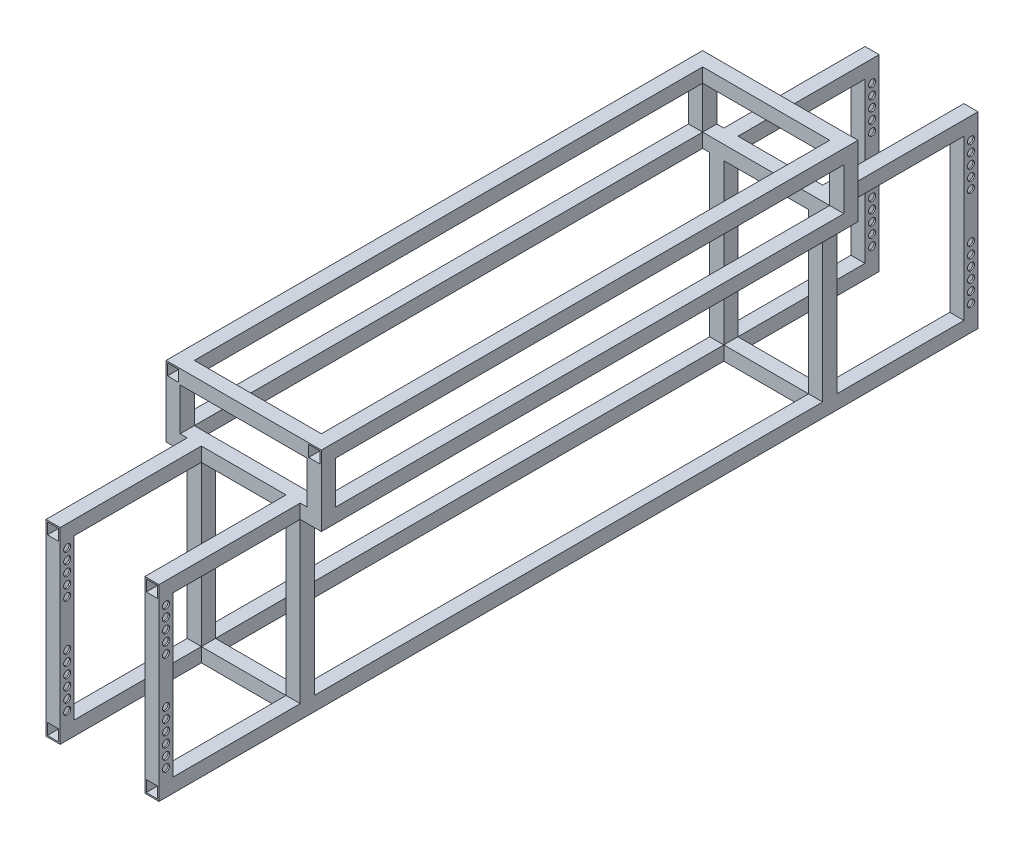
from build123d import *

# Parameters (mm, degrees)
SZKIC1_W                     = 20
SZKIC1_H                     = 20
SZKIC1_W_2                   = 16
SZKIC1_H_2                   = 16
DODANIE_WYCI_GNI_CIE1_DEPTH  = 760
SZKIC2_W                     = 20
SZKIC2_H                     = 20
SZKIC2_W_2                   = 16
SZKIC2_H_2                   = 16
DODANIE_WYCI_GNI_CIE2_DEPTH  = 180
SZKIC3_W                     = 20
SZKIC3_H                     = 20
SZKIC3_W_2                   = 16
SZKIC3_H_2                   = 16
DODANIE_WYCI_GNI_CIE3_DEPTH  = 180
SZKIC4_W                     = 20
SZKIC4_H                     = 20
SZKIC4_W_2                   = 16
SZKIC4_H_2                   = 16
DODANIE_WYCI_GNI_CIE4_DEPTH  = 760
SZKIC5_W                     = 20
SZKIC5_H                     = 20
SZKIC5_W_2                   = 16
SZKIC5_H_2                   = 16
DODANIE_WYCI_GNI_CIE5_DEPTH  = 80
DODANIE_WYCI_GNI_CIE6_REACH  = 776.468
SZKIC6_W                     = 20
SZKIC6_H                     = 20
SZKIC6_W_2                   = 16
SZKIC6_H_2                   = 16
DODANIE_WYCI_GNI_CIE7_REACH  = 793.012
SZKIC7_W                     = 20
SZKIC7_H                     = 20
SZKIC7_W_2                   = 16
SZKIC7_H_2                   = 16
SZKIC8_W                     = 20
SZKIC8_H                     = 20
SZKIC8_W_2                   = 16
SZKIC8_H_2                   = 16
DODANIE_WYCI_GNI_CIE8_DEPTH  = 200
SZKIC9_W                     = 20
SZKIC9_H                     = 20
SZKIC9_W_2                   = 16
SZKIC9_H_2                   = 16
DODANIE_WYCI_GNI_CIE9_DEPTH  = 200
SZKIC10_W                    = 20
SZKIC10_H                    = 20
SZKIC10_W_2                  = 16
SZKIC10_H_2                  = 16
DODANIE_WYCI_GNI_CIE10_DEPTH = 226
SZKIC11_W                    = 20
SZKIC11_H                    = 20
SZKIC11_W_2                  = 16
SZKIC11_H_2                  = 16
DODANIE_WYCI_GNI_CIE11_DEPTH = 246
DODANIE_WYCI_GNI_CIE12_REACH = 1022.096
SZKIC12_W                    = 20
SZKIC12_H                    = 20
SZKIC12_W_2                  = 16
SZKIC12_H_2                  = 16
DODANIE_WYCI_GNI_CIE13_REACH = 1033.211
SZKIC13_W                    = 20
SZKIC13_H                    = 20
SZKIC13_W_2                  = 16
SZKIC13_H_2                  = 16
SZKIC14_R                    = 5
WYTNIJ_WYCI_GNI_CIE1_DEPTH   = 180
SZKIC15_R                    = 5
WYTNIJ_WYCI_GNI_CIE2_DEPTH   = 180


with BuildPart() as part:
    # Szkic1 → Dodanie-wyciągnięcie1 (new body)
    with BuildSketch(Plane.XY):
        Rectangle(SZKIC1_W, SZKIC1_H)
        Rectangle(SZKIC1_W_2, SZKIC1_H_2, mode=Mode.SUBTRACT)
    extrude(amount=DODANIE_WYCI_GNI_CIE1_DEPTH)

    # Szkic2 → Dodanie-wyciągnięcie2 (add)
    with BuildSketch(Plane(origin=(10, 0, 0), x_dir=(0, 0, -1), z_dir=(1, 0, 0))):
        with Locations((-750, 0)):
            Rectangle(SZKIC2_W, SZKIC2_H)
        with Locations((-750, 0)):
            Rectangle(SZKIC2_W_2, SZKIC2_H_2, mode=Mode.SUBTRACT)
    extrude(amount=DODANIE_WYCI_GNI_CIE2_DEPTH)

    # Szkic3 → Dodanie-wyciągnięcie3 (add)
    with BuildSketch(Plane(origin=(10, 0, 0), x_dir=(0, 0, -1), z_dir=(1, 0, 0))):
        with Locations((-10, 0)):
            Rectangle(SZKIC3_W, SZKIC3_H)
        with Locations((-10, 0)):
            Rectangle(SZKIC3_W_2, SZKIC3_H_2, mode=Mode.SUBTRACT)
    extrude(amount=DODANIE_WYCI_GNI_CIE3_DEPTH)

    # Szkic4 → Dodanie-wyciągnięcie4 (add)
    with BuildSketch(Plane.XY.offset(760)):
        with Locations((200, 0)):
            Rectangle(SZKIC4_W, SZKIC4_H)
        with Locations((200, 0)):
            Rectangle(SZKIC4_W_2, SZKIC4_H_2, mode=Mode.SUBTRACT)
    extrude(amount=-DODANIE_WYCI_GNI_CIE4_DEPTH)

    # Szkic5 → Dodanie-wyciągnięcie5 (add)
    # profile 1 of 4: a face of its own
    with BuildSketch(Plane.XZ.offset(10)):
        with Locations((0, 750)):
            Rectangle(SZKIC5_W, SZKIC5_H)
        with Locations((0, 750)):
            Rectangle(SZKIC5_W_2, SZKIC5_H_2, mode=Mode.SUBTRACT)
    # profile 2 of 4: a face of its own
    with BuildSketch(Plane.XZ.offset(10)):
        with Locations((200, 750)):
            Rectangle(SZKIC5_W, SZKIC5_H)
        with Locations((200, 750)):
            Rectangle(SZKIC5_W_2, SZKIC5_H_2, mode=Mode.SUBTRACT)
    # profile 3 of 4: a face of its own
    with BuildSketch(Plane.XZ.offset(10)):
        with Locations((0, 10)):
            Rectangle(SZKIC5_W, SZKIC5_H)
        with Locations((0, 10)):
            Rectangle(SZKIC5_W_2, SZKIC5_H_2, mode=Mode.SUBTRACT)
    # profile 4 of 4: a face of its own
    with BuildSketch(Plane.XZ.offset(10)):
        with Locations((200, 10)):
            Rectangle(SZKIC5_W, SZKIC5_H)
        with Locations((200, 10)):
            Rectangle(SZKIC5_W_2, SZKIC5_H_2, mode=Mode.SUBTRACT)
    extrude(amount=DODANIE_WYCI_GNI_CIE5_DEPTH)

    # Szkic6 → Dodanie-wyciągnięcie6 (add, up to next)
    with BuildSketch(Plane.XY.offset(20), mode=Mode.PRIVATE) as dodanie_wyci_gni_cie6_sk1:
        with Locations((200, -80)):
            Rectangle(SZKIC6_W, SZKIC6_H)
        with Locations((200, -80)):
            Rectangle(SZKIC6_W_2, SZKIC6_H_2, mode=Mode.SUBTRACT)
    dodanie_wyci_gni_cie6_tool1 = extrude(dodanie_wyci_gni_cie6_sk1.sketch, amount=DODANIE_WYCI_GNI_CIE6_REACH, mode=Mode.PRIVATE) - part.part
    # Szkic6 → Dodanie-wyciągnięcie6 (add, up to next)
    with BuildSketch(Plane.XY.offset(20), mode=Mode.PRIVATE) as dodanie_wyci_gni_cie6_sk2:
        with Locations((0, -80)):
            Rectangle(SZKIC6_W, SZKIC6_H)
        with Locations((0, -80)):
            Rectangle(SZKIC6_W_2, SZKIC6_H_2, mode=Mode.SUBTRACT)
    dodanie_wyci_gni_cie6_tool2 = extrude(dodanie_wyci_gni_cie6_sk2.sketch, amount=DODANIE_WYCI_GNI_CIE6_REACH, mode=Mode.PRIVATE) - part.part
    add(dodanie_wyci_gni_cie6_tool1.solids().sort_by_distance((200, -89.717157, 20))[0])
    add(dodanie_wyci_gni_cie6_tool2.solids().sort_by_distance((0, -89.717157, 20))[0])

    # Szkic7 → Dodanie-wyciągnięcie7 (add, up to next)
    with BuildSketch(Plane(origin=(10, 0, 0), x_dir=(0, 0, -1), z_dir=(1, 0, 0)), mode=Mode.PRIVATE) as dodanie_wyci_gni_cie7_sk1:
        with Locations((-750, -80)):
            Rectangle(SZKIC7_W, SZKIC7_H)
        with Locations((-750, -80)):
            Rectangle(SZKIC7_W_2, SZKIC7_H_2, mode=Mode.SUBTRACT)
    dodanie_wyci_gni_cie7_tool1 = extrude(dodanie_wyci_gni_cie7_sk1.sketch, amount=DODANIE_WYCI_GNI_CIE7_REACH, mode=Mode.PRIVATE) - part.part
    # Szkic7 → Dodanie-wyciągnięcie7 (add, up to next)
    with BuildSketch(Plane(origin=(10, 0, 0), x_dir=(0, 0, -1), z_dir=(1, 0, 0)), mode=Mode.PRIVATE) as dodanie_wyci_gni_cie7_sk2:
        with Locations((-10, -80)):
            Rectangle(SZKIC7_W, SZKIC7_H)
        with Locations((-10, -80)):
            Rectangle(SZKIC7_W_2, SZKIC7_H_2, mode=Mode.SUBTRACT)
    dodanie_wyci_gni_cie7_tool2 = extrude(dodanie_wyci_gni_cie7_sk2.sketch, amount=DODANIE_WYCI_GNI_CIE7_REACH, mode=Mode.PRIVATE) - part.part
    add(dodanie_wyci_gni_cie7_tool1.solids().sort_by_distance((10, -89.717157, 750))[0])
    add(dodanie_wyci_gni_cie7_tool2.solids().sort_by_distance((10, -89.717157, 10))[0])

    # Szkic8 → Dodanie-wyciągnięcie8 (add)
    # profile 1 of 2: a face of its own
    with BuildSketch(Plane(origin=(0, 0, 0), x_dir=(-1, 0, 0), z_dir=(0, 0, -1))):
        with Locations((-30, -80)):
            Rectangle(SZKIC8_W, SZKIC8_H)
        with Locations((-30, -80)):
            Rectangle(SZKIC8_W_2, SZKIC8_H_2, mode=Mode.SUBTRACT)
    # profile 2 of 2: a face of its own
    with BuildSketch(Plane(origin=(0, 0, 0), x_dir=(-1, 0, 0), z_dir=(0, 0, -1))):
        with Locations((-170, -80)):
            Rectangle(SZKIC8_W, SZKIC8_H)
        with Locations((-170, -80)):
            Rectangle(SZKIC8_W_2, SZKIC8_H_2, mode=Mode.SUBTRACT)
    dodanie_wyci_gni_cie8 = extrude(amount=DODANIE_WYCI_GNI_CIE8_DEPTH)

    # Szkic9 → Dodanie-wyciągnięcie9 (add)
    # profile 1 of 2: a face of its own
    with BuildSketch(Plane.XY.offset(760)):
        with Locations((170, -80)):
            Rectangle(SZKIC9_W, SZKIC9_H)
        with Locations((170, -80)):
            Rectangle(SZKIC9_W_2, SZKIC9_H_2, mode=Mode.SUBTRACT)
    # profile 2 of 2: a face of its own
    with BuildSketch(Plane.XY.offset(760)):
        with Locations((30, -80)):
            Rectangle(SZKIC9_W, SZKIC9_H)
        with Locations((30, -80)):
            Rectangle(SZKIC9_W_2, SZKIC9_H_2, mode=Mode.SUBTRACT)
    dodanie_wyci_gni_cie9 = extrude(amount=DODANIE_WYCI_GNI_CIE9_DEPTH)

    # Szkic10 → Dodanie-wyciągnięcie10 (add)
    # profile 1 of 2: a face of its own
    with BuildSketch(Plane.XZ.offset(90)):
        with Locations((170, 950)):
            Rectangle(SZKIC10_W, SZKIC10_H)
        with Locations((170, 950)):
            Rectangle(SZKIC10_W_2, SZKIC10_H_2, mode=Mode.SUBTRACT)
    # profile 2 of 2: a face of its own
    with BuildSketch(Plane.XZ.offset(90)):
        with Locations((30, 950)):
            Rectangle(SZKIC10_W, SZKIC10_H)
        with Locations((30, 950)):
            Rectangle(SZKIC10_W_2, SZKIC10_H_2, mode=Mode.SUBTRACT)
    dodanie_wyci_gni_cie10 = extrude(amount=DODANIE_WYCI_GNI_CIE10_DEPTH)

    # Lustro1: Dodanie-wyciągnięcie10 across plane
    add(dodanie_wyci_gni_cie10.mirror(Plane(origin=(0, 0, 380), x_dir=(1, 0, 0), z_dir=(0, 0, -1))))

    # Lustro2: Dodanie-wyciągnięcie8, Dodanie-wyciągnięcie9 across plane
    add(dodanie_wyci_gni_cie8.mirror(Plane(origin=(0, -203, 0), x_dir=(0, 0, 1), z_dir=(0, -1, 0))))
    add(dodanie_wyci_gni_cie9.mirror(Plane(origin=(0, -203, 0), x_dir=(0, 0, 1), z_dir=(0, -1, 0))))

    # Szkic11 → Dodanie-wyciągnięcie11 (add)
    # profile 1 of 4: a face of its own
    with BuildSketch(Plane.XZ.offset(90)):
        with Locations((30, 10)):
            Rectangle(SZKIC11_W, SZKIC11_H)
        with Locations((30, 10)):
            Rectangle(SZKIC11_W_2, SZKIC11_H_2, mode=Mode.SUBTRACT)
    # profile 2 of 4: a face of its own
    with BuildSketch(Plane.XZ.offset(90)):
        with Locations((170, 10)):
            Rectangle(SZKIC11_W, SZKIC11_H)
        with Locations((170, 10)):
            Rectangle(SZKIC11_W_2, SZKIC11_H_2, mode=Mode.SUBTRACT)
    # profile 3 of 4: a face of its own
    with BuildSketch(Plane.XZ.offset(90)):
        with Locations((30, 750)):
            Rectangle(SZKIC11_W, SZKIC11_H)
        with Locations((30, 750)):
            Rectangle(SZKIC11_W_2, SZKIC11_H_2, mode=Mode.SUBTRACT)
    # profile 4 of 4: a face of its own
    with BuildSketch(Plane.XZ.offset(90)):
        with Locations((170, 750)):
            Rectangle(SZKIC11_W, SZKIC11_H)
        with Locations((170, 750)):
            Rectangle(SZKIC11_W_2, SZKIC11_H_2, mode=Mode.SUBTRACT)
    extrude(amount=DODANIE_WYCI_GNI_CIE11_DEPTH)

    # Szkic12 → Dodanie-wyciągnięcie12 (add, up to next)
    with BuildSketch(Plane(origin=(0, 0, 740), x_dir=(-1, 0, 0), z_dir=(0, 0, -1)), mode=Mode.PRIVATE) as dodanie_wyci_gni_cie12_sk1:
        with Locations((-170, -326)):
            Rectangle(SZKIC12_W, SZKIC12_H)
        with Locations((-170, -326)):
            Rectangle(SZKIC12_W_2, SZKIC12_H_2, mode=Mode.SUBTRACT)
    dodanie_wyci_gni_cie12_tool1 = extrude(dodanie_wyci_gni_cie12_sk1.sketch, amount=DODANIE_WYCI_GNI_CIE12_REACH, mode=Mode.PRIVATE) - part.part
    # Szkic12 → Dodanie-wyciągnięcie12 (add, up to next)
    with BuildSketch(Plane(origin=(0, 0, 740), x_dir=(-1, 0, 0), z_dir=(0, 0, -1)), mode=Mode.PRIVATE) as dodanie_wyci_gni_cie12_sk2:
        with Locations((-30, -326)):
            Rectangle(SZKIC12_W, SZKIC12_H)
        with Locations((-30, -326)):
            Rectangle(SZKIC12_W_2, SZKIC12_H_2, mode=Mode.SUBTRACT)
    dodanie_wyci_gni_cie12_tool2 = extrude(dodanie_wyci_gni_cie12_sk2.sketch, amount=DODANIE_WYCI_GNI_CIE12_REACH, mode=Mode.PRIVATE) - part.part
    add(dodanie_wyci_gni_cie12_tool1.solids().sort_by_distance((170, -335.717157, 740))[0])
    add(dodanie_wyci_gni_cie12_tool2.solids().sort_by_distance((30, -335.717157, 740))[0])

    # Szkic13 → Dodanie-wyciągnięcie13 (add, up to next)
    with BuildSketch(Plane(origin=(40, 0, 0), x_dir=(0, 0, -1), z_dir=(1, 0, 0)), mode=Mode.PRIVATE) as dodanie_wyci_gni_cie13_sk1:
        with Locations((-750, -326)):
            Rectangle(SZKIC13_W, SZKIC13_H)
        with Locations((-750, -326)):
            Rectangle(SZKIC13_W_2, SZKIC13_H_2, mode=Mode.SUBTRACT)
    dodanie_wyci_gni_cie13_tool1 = extrude(dodanie_wyci_gni_cie13_sk1.sketch, amount=DODANIE_WYCI_GNI_CIE13_REACH, mode=Mode.PRIVATE) - part.part
    dodanie_wyci_gni_cie13 = dodanie_wyci_gni_cie13_tool1.solids().sort_by_distance((40, -316.282843, 750))[0]
    add(dodanie_wyci_gni_cie13)

    # Lustro3: Dodanie-wyciągnięcie13 across plane
    add(dodanie_wyci_gni_cie13.mirror(Plane(origin=(0, 0, 380), x_dir=(1, 0, 0), z_dir=(0, 0, -1))))

    # Szkic14 → Wytnij-wyciągnięcie1 (cut)
    with BuildSketch(Plane(origin=(180, 0, 0), x_dir=(0, 0, -1), z_dir=(1, 0, 0))):
        with Locations((-950, -100)):
            Circle(SZKIC14_R)
        with Locations((-950, -115)):
            Circle(SZKIC14_R)
        with Locations((-950, -130)):
            Circle(SZKIC14_R)
        with Locations((-950, -145)):
            Circle(SZKIC14_R)
        with Locations((-950, -160)):
            Circle(SZKIC14_R)
    wytnij_wyci_gni_cie1 = extrude(amount=-WYTNIJ_WYCI_GNI_CIE1_DEPTH, mode=Mode.SUBTRACT)

    # Lustro4: Wytnij-wyciągnięcie1 across plane
    add(wytnij_wyci_gni_cie1.mirror(Plane(origin=(0, 0, 380), x_dir=(1, 0, 0), z_dir=(0, 0, -1))), mode=Mode.SUBTRACT)

    # Szkic15 → Wytnij-wyciągnięcie2 (cut)
    with BuildSketch(Plane(origin=(180, 0, 0), x_dir=(0, 0, -1), z_dir=(1, 0, 0))):
        with Locations((-950, -300)):
            Circle(SZKIC15_R)
        with Locations((-950, -285)):
            Circle(SZKIC15_R)
        with Locations((-950, -270)):
            Circle(SZKIC15_R)
        with Locations((-950, -255)):
            Circle(SZKIC15_R)
        with Locations((-950, -240)):
            Circle(SZKIC15_R)
        with Locations((-950, -225)):
            Circle(SZKIC15_R)
    wytnij_wyci_gni_cie2 = extrude(amount=-WYTNIJ_WYCI_GNI_CIE2_DEPTH, mode=Mode.SUBTRACT)

    # Lustro5: Wytnij-wyciągnięcie2 across plane
    add(wytnij_wyci_gni_cie2.mirror(Plane(origin=(0, 0, 380), x_dir=(1, 0, 0), z_dir=(0, 0, -1))), mode=Mode.SUBTRACT)


solid = part.part
